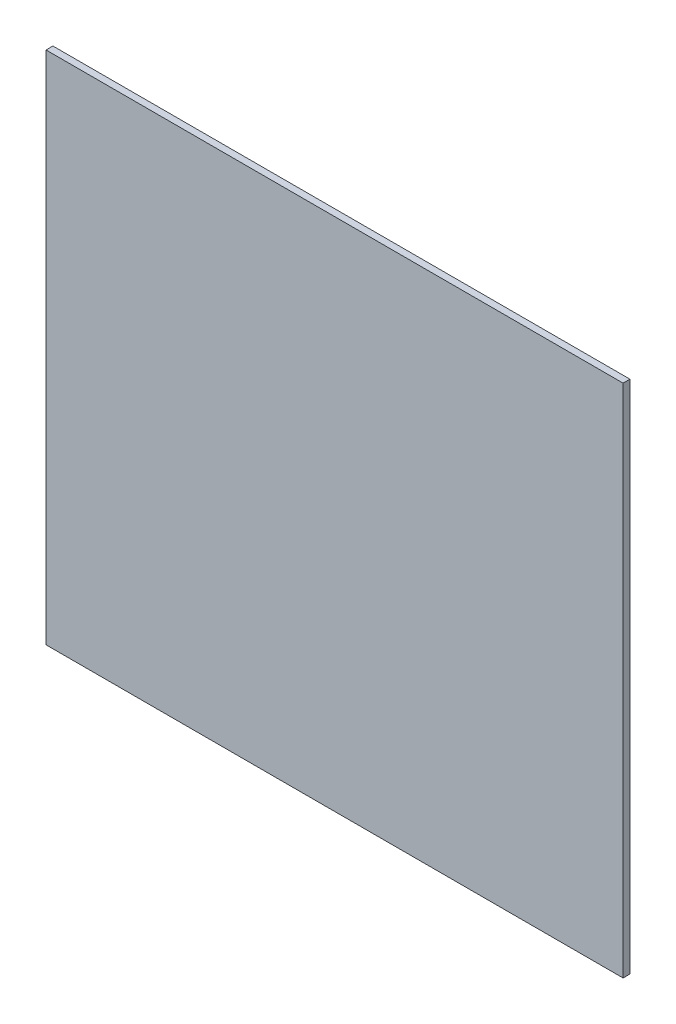
from build123d import *

# Parameters (mm, degrees)
SKETCH_1_W      = 420
SKETCH_1_H      = 374.96
EXTRUDE_1_DEPTH = 5


with BuildPart() as part:
    # 스케치1 → 보스-돌출1 (new body)
    with BuildSketch(Plane.XY):
        Rectangle(SKETCH_1_W, SKETCH_1_H)
    extrude(amount=EXTRUDE_1_DEPTH)


solid = part.part
